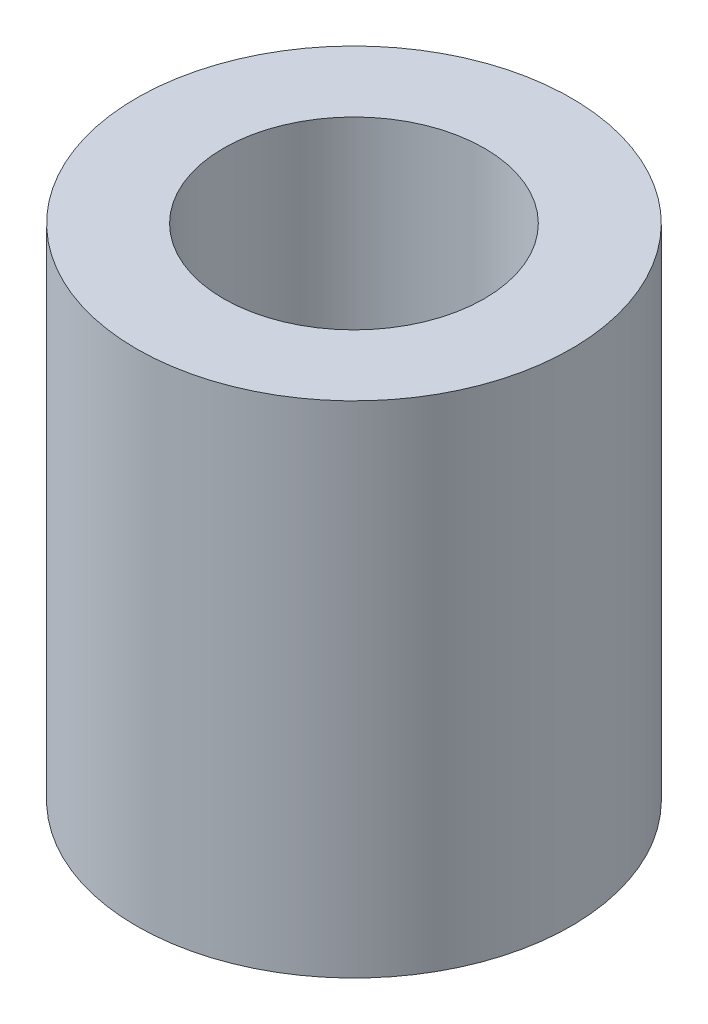
from build123d import *

# Parameters (mm, degrees)
SKETCH1_R           = 5
SKETCH1_R_2         = 3
BOSS_EXTRUDE1_DEPTH = 11.5


with BuildPart() as part:
    # Sketch1 → Boss-Extrude1 (new body)
    with BuildSketch(Plane(origin=(0, 0, 0), x_dir=(1, 0, 0), z_dir=(0, 1, 0))):
        with Locations(Location((0, 0, 0), (0, 0, 270))):
            Circle(SKETCH1_R)
        with Locations(Location((0, 0, 0), (0, 0, 270))):
            Circle(SKETCH1_R_2, mode=Mode.SUBTRACT)
    extrude(amount=BOSS_EXTRUDE1_DEPTH)


solid = part.part
